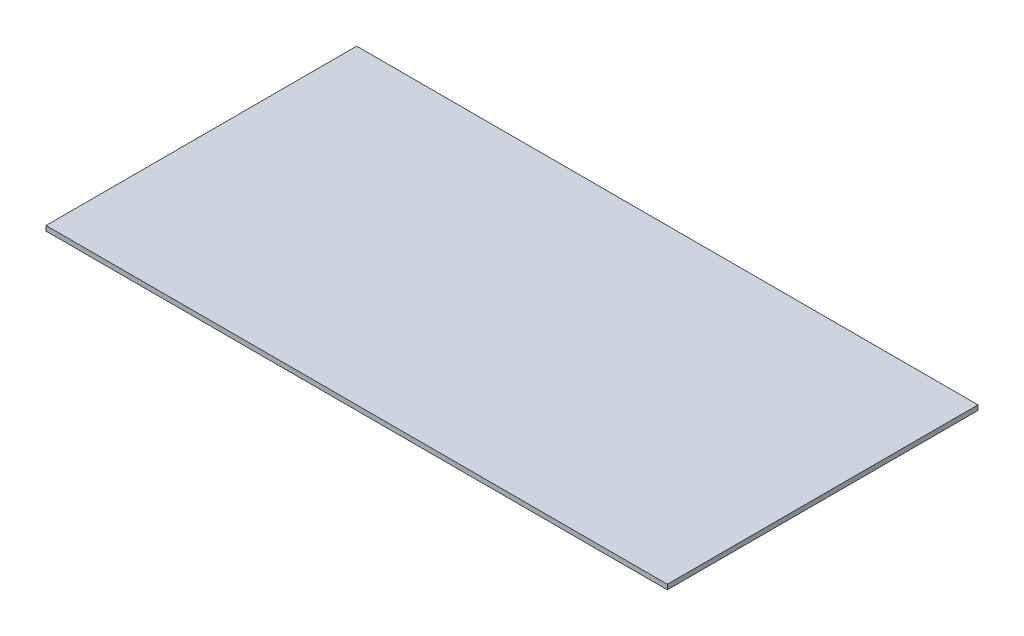
from build123d import *

# Parameters (mm, degrees)
SKETCH1_W           = 2438.4
SKETCH1_H           = 1219.2
BOSS_EXTRUDE1_DEPTH = 19.05


with BuildPart() as part:
    # Sketch1 → Boss-Extrude1 (new body)
    with BuildSketch(Plane(origin=(0, 0, 0), x_dir=(1, 0, 0), z_dir=(0, 1, 0))):
        with Locations((1219.2, 609.6)):
            Rectangle(SKETCH1_W, SKETCH1_H)
    extrude(amount=-BOSS_EXTRUDE1_DEPTH)


solid = part.part
